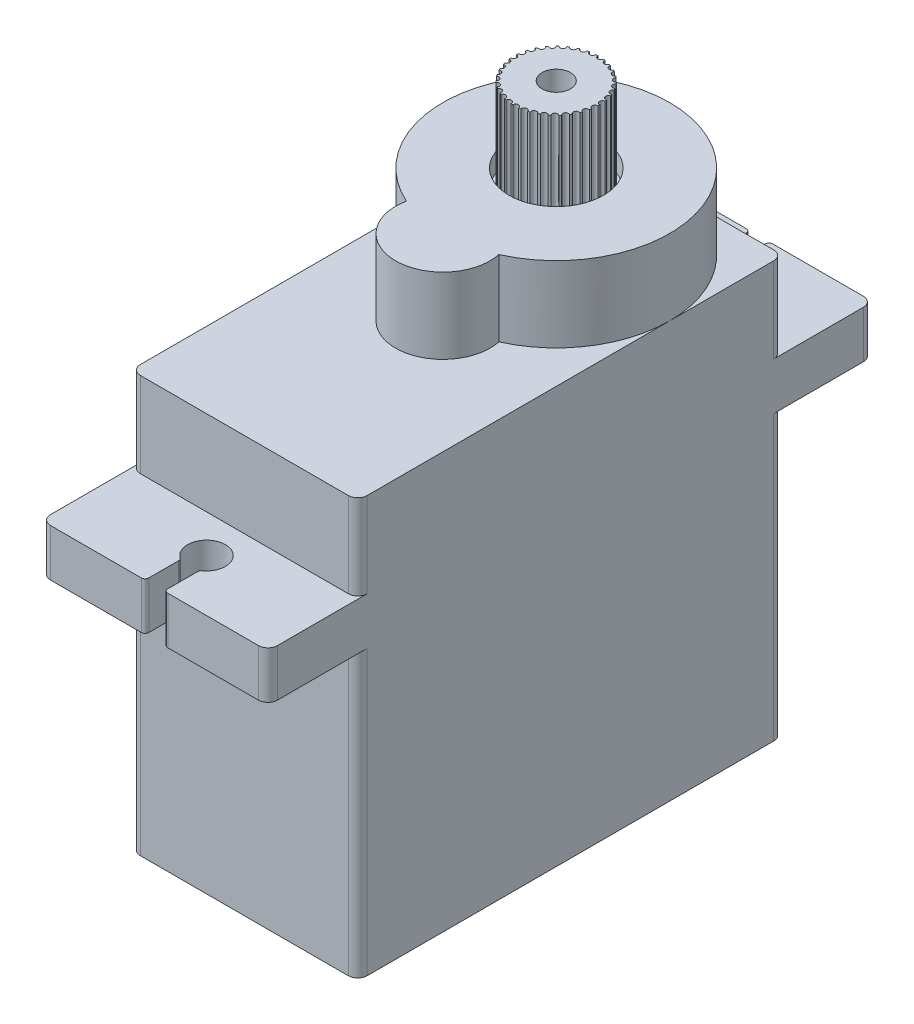
from build123d import *

# Parameters (mm, degrees)
Y_KSEKLIK_EKSTR_ZYON1_DEPTH  = 1
Y_KSEKLIK_EKSTR_ZYON2_DEPTH  = 5
IZIM3_W                      = 4
IZIM3_H                      = 1
KES_EKSTR_ZYON1_DEPTH        = 1
RADYUS1_R                    = 0.1
Y_KSEKLIK_EKSTR_ZYON4_DEPTH  = 9
Y_KSEKLIK_EKSTR_ZYON5_DEPTH  = 2.5
Y_KSEKLIK_EKSTR_ZYON6_DEPTH  = 3.5
Y_KSEKLIK_EKSTR_ZYON7_DEPTH  = 1
KES_EKSTR_ZYON2_DEPTH        = 1
Y_KSEKLIK_EKSTR_ZYON8_START  = 3
Y_KSEKLIK_EKSTR_ZYON8_DEPTH  = 3
RADYUS2_R                    = 0.5
Y_KSEKLIK_EKSTR_ZYON9_START  = 1
Y_KSEKLIK_EKSTR_ZYON9_DEPTH  = 1
IZIM11_R                     = 2.5
KES_EKSTR_ZYON3_DEPTH        = 10
IZIM15_R                     = 0.25
Y_KSEKLIK_EKSTR_ZYON12_DEPTH = 11
IZIM19_R                     = 2.25
Y_KSEKLIK_EKSTR_ZYON17_DEPTH = 5
IZIM20_R                     = 4.75
Y_KSEKLIK_EKSTR_ZYON18_DEPTH = 3
IZIM21_R                     = 0.75
KES_EKSTR_ZYON5_DEPTH        = 10
IZIM22_R                     = 0.5
Y_KSEKLIK_EKSTR_ZYON19_DEPTH = 5
IZIM23_R                     = 4
Y_KSEKLIK_EKSTR_ZYON20_DEPTH = 2
IZIM24_R                     = 0.75
Y_KSEKLIK_EKSTR_ZYON21_DEPTH = 7
IZIM25_R                     = 3.5
Y_KSEKLIK_EKSTR_ZYON22_DEPTH = 1
IZIM26_R                     = 4.5
Y_KSEKLIK_EKSTR_ZYON23_DEPTH = 1
KES_EKSTR_ZYON7_DEPTH        = 30
Y_KSEKLIK_EKSTR_ZYON33_DEPTH = 1
Y_KSEKLIK_EKSTR_ZYON34_DEPTH = 14
IZIM37_W                     = 8
IZIM37_H                     = 6
Y_KSEKLIK_EKSTR_ZYON36_DEPTH = 1
IZIM39_W                     = 4
IZIM39_H                     = 1
Y_KSEKLIK_EKSTR_ZYON37_DEPTH = 0.1
IZIM40_R                     = 0.4
Y_KSEKLIK_EKSTR_ZYON38_DEPTH = 2
IZIM41_R                     = 0.15
KES_EKSTR_ZYON8_DEPTH        = 5


with BuildPart() as part:
    # Çizim1 → Yükseklik-Ekstrüzyon1 (new body)
    with BuildSketch(Plane(origin=(0, 0, 0), x_dir=(1, 0, 0), z_dir=(0, 1, 0))):
        with BuildLine():
            Line((-5.5, 11.25), (5.5, 11.25))
            ThreePointArc((5.5, 11.25), (5.853553391, 11.103553391), (6, 10.75))
            Line((6, 10.75), (6, -10.75))
            ThreePointArc((6, -10.75), (5.853553391, -11.103553391), (5.5, -11.25))
            Line((5.5, -11.25), (-5.5, -11.25))
            ThreePointArc((-5.5, -11.25), (-5.853553391, -11.103553391), (-6, -10.75))
            Line((-6, -10.75), (-6, 10.75))
            ThreePointArc((-6, 10.75), (-5.853553391, 11.103553391), (-5.5, 11.25))
        make_face()
    extrude(amount=Y_KSEKLIK_EKSTR_ZYON1_DEPTH)

    # Çizim2 → Yükseklik-Ekstrüzyon2 (add)
    with BuildSketch(Plane(origin=(0, 1, 0), x_dir=(1, 0, 0), z_dir=(0, 1, 0))):
        with BuildLine():
            Line((-5.5, 11.25), (5.5, 11.25))
            ThreePointArc((5.5, 11.25), (5.853553391, 11.103553391), (6, 10.75))
            Line((6, 10.75), (6, -10.75))
            ThreePointArc((6, -10.75), (5.853553391, -11.103553391), (5.5, -11.25))
            Line((5.5, -11.25), (-5.5, -11.25))
            ThreePointArc((-5.5, -11.25), (-5.853553391, -11.103553391), (-6, -10.75))
            Line((-6, -10.75), (-6, 10.75))
            ThreePointArc((-6, 10.75), (-5.853553391, 11.103553391), (-5.5, 11.25))
        make_face()
        with BuildLine():
            Line((-5, 9.25), (-5, -9.25))
            ThreePointArc((-5, -9.25), (-4.292893219, -9.542893219), (-4, -10.25))
            Line((-4, -10.25), (4, -10.25))
            ThreePointArc((4, -10.25), (4.292893219, -9.542893219), (5, -9.25))
            Line((5, -9.25), (5, 9.25))
            ThreePointArc((5, 9.25), (4.292893219, 9.542893219), (4, 10.25))
            Line((4, 10.25), (-4, 10.25))
            ThreePointArc((-4, 10.25), (-4.292893219, 9.542893219), (-5, 9.25))
        make_face(mode=Mode.SUBTRACT)
    extrude(amount=Y_KSEKLIK_EKSTR_ZYON2_DEPTH)

    # Çizim3 → Kes-Ekstrüzyon1 (cut)
    with BuildSketch(Plane(origin=(0, 6, 0), x_dir=(1, 0, 0), z_dir=(0, 1, 0))):
        with Locations((0, -10.75)):
            Rectangle(IZIM3_W, IZIM3_H)
    extrude(amount=-KES_EKSTR_ZYON1_DEPTH, mode=Mode.SUBTRACT)

    # Radyus1
    radyus1_edges = [part.edges().sort_by_distance(p)[0] for p in [
        (2, 5, 10.75),
        (-2, 5, 10.75),
    ]]
    fillet(radyus1_edges, radius=RADYUS1_R)

    # Çizim4 → Yükseklik-Ekstrüzyon4 (add)
    with BuildSketch(Plane(origin=(0, 6, 0), x_dir=(1, 0, 0), z_dir=(0, 1, 0))):
        with BuildLine():
            Line((-5.5, 11.25), (5.5, 11.25))
            ThreePointArc((5.5, 11.25), (5.853553391, 11.103553391), (6, 10.75))
            Line((6, 10.75), (6, -10.75))
            ThreePointArc((6, -10.75), (5.853553391, -11.103553391), (5.5, -11.25))
            Line((5.5, -11.25), (-5.5, -11.25))
            ThreePointArc((-5.5, -11.25), (-5.853553391, -11.103553391), (-6, -10.75))
            Line((-6, -10.75), (-6, 10.75))
            ThreePointArc((-6, 10.75), (-5.853553391, 11.103553391), (-5.5, 11.25))
        make_face()
        with BuildLine():
            Line((-4, 10.25), (4, 10.25))
            ThreePointArc((4, 10.25), (4.292893219, 9.542893219), (5, 9.25))
            Line((5, 9.25), (5, -9.25))
            ThreePointArc((5, -9.25), (4.292893219, -9.542893219), (4, -10.25))
            Line((4, -10.25), (-4, -10.25))
            ThreePointArc((-4, -10.25), (-4.292893219, -9.542893219), (-5, -9.25))
            Line((-5, -9.25), (-5, 9.25))
            ThreePointArc((-5, 9.25), (-4.292893219, 9.542893219), (-4, 10.25))
        make_face(mode=Mode.SUBTRACT)
    extrude(amount=Y_KSEKLIK_EKSTR_ZYON4_DEPTH)

    # Çizim6 → Yükseklik-Ekstrüzyon5 (add)
    with BuildSketch(Plane(origin=(0, 15, 0), x_dir=(1, 0, 0), z_dir=(0, 1, 0))):
        with BuildLine():
            Line((-5.5, 16), (-0.7, 16))
            ThreePointArc((-0.7, 16), (-0.558578644, 15.941421356), (-0.5, 15.8))
            Line((-0.5, 15.8), (-0.5, 14.224679434))
            ThreePointArc((-0.5, 14.224679434), (-0.522048696, 14.133392342), (-0.583333333, 14.062232862))
            ThreePointArc((-0.583333333, 14.062232862), (0, 12.25), (0.583333333, 14.062232862))
            ThreePointArc((0.583333333, 14.062232862), (0.522048696, 14.133392342), (0.5, 14.224679434))
            Line((0.5, 14.224679434), (0.5, 15.8))
            ThreePointArc((0.5, 15.8), (0.558578644, 15.941421356), (0.7, 16))
            Line((0.7, 16), (5.5, 16))
            ThreePointArc((5.5, 16), (5.853553391, 15.853553391), (6, 15.5))
            Line((6, 15.5), (6, -15.5))
            ThreePointArc((6, -15.5), (5.853553391, -15.853553391), (5.5, -16))
            Line((5.5, -16), (0.7, -16))
            ThreePointArc((0.7, -16), (0.558578644, -15.941421356), (0.5, -15.8))
            Line((0.5, -15.8), (0.5, -14.224679434))
            ThreePointArc((0.5, -14.224679434), (0.522048696, -14.133392342), (0.583333333, -14.062232862))
            ThreePointArc((0.583333333, -14.062232862), (0, -12.25), (-0.583333333, -14.062232862))
            ThreePointArc((-0.583333333, -14.062232862), (-0.522048696, -14.133392342), (-0.5, -14.224679434))
            Line((-0.5, -14.224679434), (-0.5, -15.8))
            ThreePointArc((-0.5, -15.8), (-0.558578644, -15.941421356), (-0.7, -16))
            Line((-0.7, -16), (-5.5, -16))
            ThreePointArc((-5.5, -16), (-5.853553391, -15.853553391), (-6, -15.5))
            Line((-6, -15.5), (-6, 15.5))
            ThreePointArc((-6, 15.5), (-5.853553391, 15.853553391), (-5.5, 16))
        make_face()
        with BuildLine():
            Line((-4, 10.25), (4, 10.25))
            ThreePointArc((4, 10.25), (4.292893219, 9.542893219), (5, 9.25))
            Line((5, 9.25), (5, -9.25))
            ThreePointArc((5, -9.25), (4.292893219, -9.542893219), (4, -10.25))
            Line((4, -10.25), (-4, -10.25))
            ThreePointArc((-4, -10.25), (-4.292893219, -9.542893219), (-5, -9.25))
            Line((-5, -9.25), (-5, 9.25))
            ThreePointArc((-5, 9.25), (-4.292893219, 9.542893219), (-4, 10.25))
        make_face(mode=Mode.SUBTRACT)
    extrude(amount=Y_KSEKLIK_EKSTR_ZYON5_DEPTH)

    # Çizim7 → Yükseklik-Ekstrüzyon6 (add)
    with BuildSketch(Plane(origin=(0, 17.5, 0), x_dir=(1, 0, 0), z_dir=(0, 1, 0))):
        with BuildLine():
            Line((5.5, 11.25), (-5.5, 11.25))
            ThreePointArc((-5.5, 11.25), (-5.853553391, 11.103553391), (-6, 10.75))
            Line((-6, 10.75), (-6, -10.75))
            ThreePointArc((-6, -10.75), (-5.853553391, -11.103553391), (-5.5, -11.25))
            Line((-5.5, -11.25), (5.5, -11.25))
            ThreePointArc((5.5, -11.25), (5.853553391, -11.103553391), (6, -10.75))
            Line((6, -10.75), (6, 10.75))
            ThreePointArc((6, 10.75), (5.853553391, 11.103553391), (5.5, 11.25))
        make_face()
        with BuildLine():
            Line((-5, -9.25), (-5, 9.25))
            ThreePointArc((-5, 9.25), (-4.292893219, 9.542893219), (-4, 10.25))
            Line((-4, 10.25), (4, 10.25))
            ThreePointArc((4, 10.25), (4.292893219, 9.542893219), (5, 9.25))
            Line((5, 9.25), (5, -9.25))
            ThreePointArc((5, -9.25), (4.292893219, -9.542893219), (4, -10.25))
            Line((4, -10.25), (-4, -10.25))
            ThreePointArc((-4, -10.25), (-4.292893219, -9.542893219), (-5, -9.25))
        make_face(mode=Mode.SUBTRACT)
    extrude(amount=Y_KSEKLIK_EKSTR_ZYON6_DEPTH)

    # Çizim8 → Yükseklik-Ekstrüzyon7 (add)
    with BuildSketch(Plane(origin=(0, 21, 0), x_dir=(1, 0, 0), z_dir=(0, 1, 0))):
        with BuildLine():
            Line((-5.5, 11.25), (5.5, 11.25))
            ThreePointArc((5.5, 11.25), (5.853553391, 11.103553391), (6, 10.75))
            Line((6, 10.75), (6, -10.75))
            ThreePointArc((6, -10.75), (5.853553391, -11.103553391), (5.5, -11.25))
            Line((5.5, -11.25), (-5.5, -11.25))
            ThreePointArc((-5.5, -11.25), (-5.853553391, -11.103553391), (-6, -10.75))
            Line((-6, -10.75), (-6, 10.75))
            ThreePointArc((-6, 10.75), (-5.853553391, 11.103553391), (-5.5, 11.25))
        make_face()
    extrude(amount=Y_KSEKLIK_EKSTR_ZYON7_DEPTH)

    # Çizim9 → Kes-Ekstrüzyon2 (cut)
    with BuildSketch(Plane(origin=(0, 22, 0), x_dir=(1, 0, 0), z_dir=(0, 1, 0))):
        with BuildLine():
            ThreePointArc((1.015291078, 0.354166667), (0, 10.25), (-1.015291078, 0.354166667))
            ThreePointArc((-1.015291078, 0.354166667), (0, -2.25), (1.015291078, 0.354166667))
        make_face()
    extrude(amount=-KES_EKSTR_ZYON2_DEPTH, mode=Mode.SUBTRACT)

    # Çizim9<3> → Yükseklik-Ekstrüzyon8 (add)
    with BuildSketch(Plane(origin=(0, 22, 0), x_dir=(1, 0, 0), z_dir=(0, 1, 0)).offset(Y_KSEKLIK_EKSTR_ZYON8_START)):
        with BuildLine():
            ThreePointArc((2.445144707, -0.229166667), (0, 11.25), (-2.445144707, -0.229166667))
            ThreePointArc((-2.445144707, -0.229166667), (0, -3.25), (2.445144707, -0.229166667))
        make_face()
        with BuildLine():
            ThreePointArc((1.015291078, 0.354166667), (0, 10.25), (-1.015291078, 0.354166667))
            ThreePointArc((-1.015291078, 0.354166667), (0, -2.25), (1.015291078, 0.354166667))
        make_face(mode=Mode.SUBTRACT)
    extrude(amount=-Y_KSEKLIK_EKSTR_ZYON8_DEPTH)

    # Radyus2
    radyus2_edges = [part.edges().sort_by_distance(p)[0] for p in [
        (-1.015291078, 23, -0.354166667),
        (1.015291078, 23, -0.354166667),
    ]]
    fillet(radyus2_edges, radius=RADYUS2_R)

    # Çizim10 → Yükseklik-Ekstrüzyon9 (add)
    with BuildSketch(Plane(origin=(0, 25, 0), x_dir=(1, 0, 0), z_dir=(0, 1, 0)).offset(Y_KSEKLIK_EKSTR_ZYON9_START)):
        with BuildLine():
            ThreePointArc((2.445144707, -0.229166667), (0, 11.25), (-2.445144707, -0.229166667))
            ThreePointArc((-2.445144707, -0.229166667), (0, -3.25), (2.445144707, -0.229166667))
        make_face()
    extrude(amount=-Y_KSEKLIK_EKSTR_ZYON9_DEPTH)

    # Çizim11 → Kes-Ekstrüzyon3 (cut)
    with BuildSketch(Plane(origin=(0, 26, 0), x_dir=(1, 0, 0), z_dir=(0, 1, 0))):
        with Locations(Location((0, 5.25, 0), (0, 0, 270))):
            Circle(IZIM11_R)
    extrude(amount=-KES_EKSTR_ZYON3_DEPTH, mode=Mode.SUBTRACT)

    # Çizim15 → Yükseklik-Ekstrüzyon12 (add)
    with BuildSketch(Plane(origin=(0, 26, 0), x_dir=(1, 0, 0), z_dir=(0, 1, 0))):
        with Locations(Location((0, -0.75, 0), (0, 0, 270))):
            Circle(IZIM15_R)
    extrude(amount=-Y_KSEKLIK_EKSTR_ZYON12_DEPTH)



with BuildPart() as body_2:
    # Çizim19 → Yükseklik-Ekstrüzyon17 (new body)
    with BuildSketch(Plane(origin=(0, 30, 0), x_dir=(1, 0, 0), z_dir=(0, 1, 0))):
        with Locations(Location((0, 5.25, 0), (0, 0, 270))):
            Circle(IZIM19_R)
    extrude(amount=-Y_KSEKLIK_EKSTR_ZYON17_DEPTH)


with BuildPart() as part_1:
    add(part.part)

    add(body_2.part)  # Yükseklik-Ekstrüzyon18 merges body 2
    # Çizim20 → Yükseklik-Ekstrüzyon18 (add)
    with BuildSketch(Plane.XZ.offset(-25)):
        with Locations(Location((0, -5.25, 0), (0, 0, 90))):
            Circle(IZIM20_R)
    extrude(amount=Y_KSEKLIK_EKSTR_ZYON18_DEPTH)

    # Çizim21 → Kes-Ekstrüzyon5 (cut)
    with BuildSketch(Plane(origin=(0, 30, 0), x_dir=(1, 0, 0), z_dir=(0, 1, 0))):
        with Locations(Location((0, 5.25, 0), (0, 0, 270))):
            Circle(IZIM21_R)
    extrude(amount=-KES_EKSTR_ZYON5_DEPTH, mode=Mode.SUBTRACT)

    # Çizim22 → Yükseklik-Ekstrüzyon19 (add)
    with BuildSketch(Plane(origin=(0, 25.5, 0), x_dir=(1, 0, 0), z_dir=(0, 1, 0))):
        with Locations(Location((0, -0.75, 0), (0, 0, 270))):
            Circle(IZIM22_R)
    extrude(amount=-Y_KSEKLIK_EKSTR_ZYON19_DEPTH)

    # Çizim23 → Yükseklik-Ekstrüzyon20 (add)
    with BuildSketch(Plane.XZ.offset(-20.5)):
        with Locations(Location((0, 0.75, 0), (0, 0, 270))):
            Circle(IZIM23_R)
    extrude(amount=Y_KSEKLIK_EKSTR_ZYON20_DEPTH)

    # Çizim26 → Yükseklik-Ekstrüzyon23 (add)
    with BuildSketch(Plane(origin=(0, 17.5, 0), x_dir=(-1, 0, 0), z_dir=(0, -1, 0))):
        with Locations(Location((0, -0.75, 0), (0, 0, 90))):
            Circle(IZIM26_R)
    extrude(amount=Y_KSEKLIK_EKSTR_ZYON23_DEPTH)

    # Çizim32 → Kes-Ekstrüzyon7 (cut)
    with BuildSketch(Plane(origin=(0, 0, 10.25), x_dir=(-1, 0, 0), z_dir=(0, 0, -1))):
        with BuildLine():
            Line((2, 6), (-2, 6))
            Line((-2, 6), (-2, 5.1))
            ThreePointArc((-2, 5.1), (-1.970710678, 5.029289322), (-1.9, 5))
            Line((-1.9, 5), (1.9, 5))
            ThreePointArc((1.9, 5), (1.970710678, 5.029289322), (2, 5.1))
            Line((2, 5.1), (2, 6))
        make_face()
    extrude(amount=KES_EKSTR_ZYON7_DEPTH, mode=Mode.SUBTRACT)

    # Çizim33 → Yükseklik-Ekstrüzyon33 (add)
    with BuildSketch(Plane.XY.offset(11.25)):
        with BuildLine():
            Line((-2, 6), (2, 6))
            Line((2, 6), (2, 5.1))
            ThreePointArc((2, 5.1), (1.970710678, 5.029289322), (1.9, 5))
            Line((1.9, 5), (-1.9, 5))
            ThreePointArc((-1.9, 5), (-1.970710678, 5.029289322), (-2, 5.1))
            Line((-2, 5.1), (-2, 6))
        make_face()
    extrude(amount=-Y_KSEKLIK_EKSTR_ZYON33_DEPTH)

    # Çizim34 → Yükseklik-Ekstrüzyon34 (add)
    with BuildSketch(Plane(origin=(0, 1, 0), x_dir=(1, 0, 0), z_dir=(0, 1, 0))):
        with BuildLine():
            Line((-3, -3.25), (3, -3.25))
            ThreePointArc((3, -3.25), (3.707106781, -3.542893219), (4, -4.25))
            Line((4, -4.25), (4, -8.25))
            ThreePointArc((4, -8.25), (3.707106781, -8.957106781), (3, -9.25))
            Line((3, -9.25), (-3, -9.25))
            ThreePointArc((-3, -9.25), (-3.707106781, -8.957106781), (-4, -8.25))
            Line((-4, -8.25), (-4, -4.25))
            ThreePointArc((-4, -4.25), (-3.707106781, -3.542893219), (-3, -3.25))
        make_face()
    extrude(amount=Y_KSEKLIK_EKSTR_ZYON34_DEPTH)

    # Çizim37 → Yükseklik-Ekstrüzyon36 (add)
    with BuildSketch(Plane(origin=(0, 1, 0), x_dir=(-1, 0, 0), z_dir=(0, -1, 0))):
        with Locations((0, -6.25)):
            Rectangle(IZIM37_W, IZIM37_H)
    extrude(amount=-Y_KSEKLIK_EKSTR_ZYON36_DEPTH)

    # Çizim39 → Yükseklik-Ekstrüzyon37 (add)
    with BuildSketch(Plane(origin=(0, 0, -10.75), x_dir=(-1, 0, 0), z_dir=(0, 0, -1))):
        with Locations((0, 5.514566781)):
            Rectangle(IZIM39_W, IZIM39_H)
    extrude(amount=Y_KSEKLIK_EKSTR_ZYON37_DEPTH)

    # Çizim40 → Yükseklik-Ekstrüzyon38 (add)
    with BuildSketch(Plane(origin=(0, 0, -10.85), x_dir=(-1, 0, 0), z_dir=(0, 0, -1))):
        with Locations((0, 5.55)):
            Circle(IZIM40_R)
        with Locations((1, 5.55)):
            Circle(IZIM40_R)
        with Locations((-1, 5.55)):
            Circle(IZIM40_R)
    extrude(amount=Y_KSEKLIK_EKSTR_ZYON38_DEPTH)

    # Çizim41 → Kes-Ekstrüzyon8 (cut)
    with BuildSketch(Plane(origin=(0, 30, 0), x_dir=(1, 0, 0), z_dir=(0, 1, 0))):
        with Locations((-2.25, 5.25)):
            Circle(IZIM41_R)
        with Locations((-2.213841574, 5.651753013)):
            Circle(IZIM41_R)
        with Locations((-2.106528459, 6.040593354)):
            Circle(IZIM41_R)
        with Locations((-1.931509786, 6.404023374)):
            Circle(IZIM41_R)
        with Locations((-1.694410799, 6.730362133)):
            Circle(IZIM41_R)
        with Locations((-1.402852054, 7.009120836)):
            Circle(IZIM41_R)
        with Locations((-1.066204491, 7.231339947)):
            Circle(IZIM41_R)
        with Locations((-0.695288237, 7.389877162)):
            Circle(IZIM41_R)
        with Locations((-0.302024848, 7.479636964)):
            Circle(IZIM41_R)
        with Locations((0.100945868, 7.4977344)):
            Circle(IZIM41_R)
        with Locations((0.500672101, 7.443587802)):
            Circle(IZIM41_R)
        with Locations((0.884306321, 7.318937488)):
            Circle(IZIM41_R)
        with Locations((1.239518208, 7.127789821)):
            Circle(IZIM41_R)
        with Locations((1.55489096, 6.876288444)):
            Circle(IZIM41_R)
        with Locations((1.820288237, 6.572516818)):
            Circle(IZIM41_R)
        with Locations((2.027179953, 6.226238413)):
            Circle(IZIM41_R)
        with Locations((2.168916437, 5.848582903)):
            Circle(IZIM41_R)
        with Locations((2.240942161, 5.451688445)):
            Circle(IZIM41_R)
        with Locations((2.240942161, 5.048311555)):
            Circle(IZIM41_R)
        with Locations((2.168916437, 4.651417097)):
            Circle(IZIM41_R)
        with Locations((2.027179953, 4.273761587)):
            Circle(IZIM41_R)
        with Locations((1.820288237, 3.927483182)):
            Circle(IZIM41_R)
        with Locations((1.55489096, 3.623711556)):
            Circle(IZIM41_R)
        with Locations((1.239518208, 3.372210179)):
            Circle(IZIM41_R)
        with Locations((0.884306321, 3.181062512)):
            Circle(IZIM41_R)
        with Locations((0.500672101, 3.056412198)):
            Circle(IZIM41_R)
        with Locations((0.100945868, 3.0022656)):
            Circle(IZIM41_R)
        with Locations((-0.302024848, 3.020363036)):
            Circle(IZIM41_R)
        with Locations((-0.695288237, 3.110122838)):
            Circle(IZIM41_R)
        with Locations((-1.066204491, 3.268660053)):
            Circle(IZIM41_R)
        with Locations((-1.402852054, 3.490879164)):
            Circle(IZIM41_R)
        with Locations((-1.694410799, 3.769637867)):
            Circle(IZIM41_R)
        with Locations((-1.931509786, 4.095976626)):
            Circle(IZIM41_R)
        with Locations((-2.106528459, 4.459406646)):
            Circle(IZIM41_R)
        with Locations((-2.213841574, 4.848246987)):
            Circle(IZIM41_R)
    extrude(amount=-KES_EKSTR_ZYON8_DEPTH, mode=Mode.SUBTRACT)


with BuildPart() as body_2_2:
    # Çizim24 → Yükseklik-Ekstrüzyon21 (new body)
    with BuildSketch(Plane.XZ.offset(-22)):
        with Locations(Location((0, -5.25, 0), (0, 0, 270))):
            Circle(IZIM24_R)
    extrude(amount=Y_KSEKLIK_EKSTR_ZYON21_DEPTH)

    # Çizim25 → Yükseklik-Ekstrüzyon22 (add)
    with BuildSketch(Plane(origin=(0, 19, 0), x_dir=(-1, 0, 0), z_dir=(0, -1, 0))):
        with Locations(Location((0, 5.25, 0), (0, 0, 90))):
            Circle(IZIM25_R)
    extrude(amount=Y_KSEKLIK_EKSTR_ZYON22_DEPTH)


solid = Compound([part_1.part, body_2_2.part])
